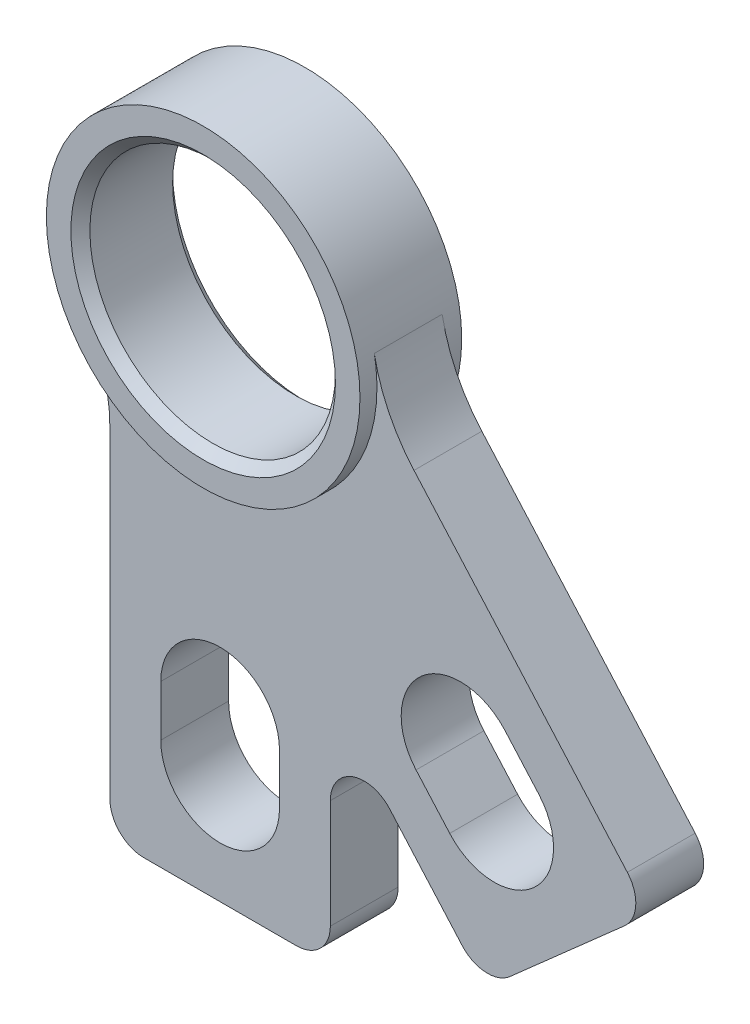
from build123d import *

# Parameters (mm, degrees)
SKETCH1_R           = 11.495405
BOSS_EXTRUDE2_DEPTH = 4.7625
BOSS_EXTRUDE3_DEPTH = 3.175
FILLET1_R           = 3.175
CHAMFER1_SIZE       = 0.889


with BuildPart() as part:
    # Sketch1 → Boss-Extrude2 (new, symmetric)
    with BuildSketch(Plane.XY):
        with BuildLine():
            ThreePointArc((14.43672871, 2.668051275), (-5.197044393, 13.730563099), (-12.585193267, -7.559797873))
            ThreePointArc((-12.585193267, -7.559797873), (5.197044393, -13.730563099), (14.43672871, 2.668051275))
        make_face()
        Circle(SKETCH1_R, mode=Mode.SUBTRACT)
    extrude(amount=BOSS_EXTRUDE2_DEPTH, both=True)

    # Sketch1<4> → Boss-Extrude3 (add, symmetric)
    with BuildSketch(Plane.XY):
        with BuildLine():
            ThreePointArc((-12.585193267, -7.559797873), (-10.89585042, -11.492870345), (-10.31875, -15.734319794))
            Line((-10.31875, -15.734319794), (-10.31875, -49.008319794))
            Line((-10.31875, -49.008319794), (10.31875, -49.008319794))
            Line((10.31875, -49.008319794), (10.31875, -27.262081536))
            Line((10.31875, -27.262081536), (24.759911139, -43.605812684))
            Line((24.759911139, -43.605812684), (40.225193096, -29.940840667))
            Line((40.225193096, -29.940840667), (18.15100753, -4.958462121))
            ThreePointArc((18.15100753, -4.958462121), (15.775028495, -1.397891668), (14.43672871, 2.668051275))
            ThreePointArc((14.43672871, 2.668051275), (5.197044393, -13.730563099), (-12.585193267, -7.559797873))
        make_face()
        with BuildLine():
            ThreePointArc((5.55625, -38.689569794), (0, -44.245819794), (-5.55625, -38.689569794))
            Line((-5.55625, -38.689569794), (-5.55625, -33.927069794))
            ThreePointArc((-5.55625, -33.927069794), (0, -28.370819794), (5.55625, -33.927069794))
            Line((5.55625, -33.927069794), (5.55625, -38.689569794))
        make_face(mode=Mode.SUBTRACT)
        with BuildLine():
            ThreePointArc((29.823795866, -25.361654769), (29.339097036, -33.204415455), (21.496336351, -32.719716625))
            Line((21.496336351, -32.719716625), (18.34288127, -29.150805404))
            ThreePointArc((18.34288127, -29.150805404), (18.8275801, -21.308044718), (26.670340785, -21.792743548))
            Line((26.670340785, -21.792743548), (29.823795866, -25.361654769))
        make_face(mode=Mode.SUBTRACT)
    extrude(amount=BOSS_EXTRUDE3_DEPTH, both=True)

    # Fillet1
    fillet1_edges = [part.edges().sort_by_distance(p)[0] for p in [
        (-10.31875, -49.008319794, 0),
        (40.225193096, -29.940840667, 0),
        (10.31875, -27.262081536, 0),
        (24.759911139, -43.605812684, 0),
        (10.31875, -49.008319794, 0),
    ]]
    fillet(fillet1_edges, radius=FILLET1_R)

    # Chamfer1
    chamfer1_edges = [part.edges().sort_by_distance(p)[0] for p in [
        (-11.495405, 0, 4.7625),
        (-11.495405, 0, -4.7625),
    ]]
    chamfer(chamfer1_edges, length=CHAMFER1_SIZE)


solid = part.part
